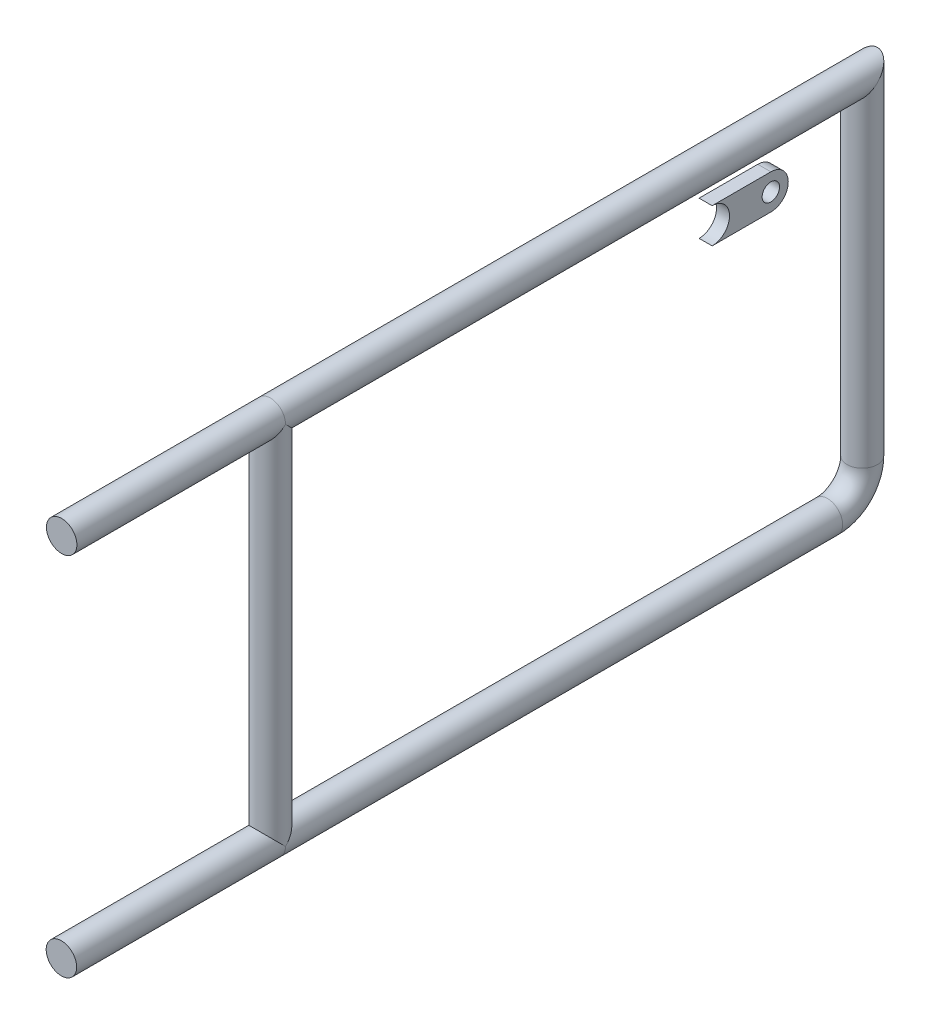
from build123d import *

# Parameters (mm, degrees)
SKETCH3_R           = 11.1125
SKETCH3_8_R         = 11.1125
SKETCH11_R          = 6.35
BOSS_EXTRUDE1_DEPTH = 9.525


with BuildPart() as part:
    # Sweep1: sweep along a path in Sketch1
    with BuildLine(Plane(origin=(0, 0, 0), x_dir=(0, 0, -1), z_dir=(1, 0, 0))) as sweep1_path:
        Line((0, -431.8), (152.212779539, -431.8))
        Line((152.212779539, -431.8), (584.012779539, -431.8))
        Line((584.012779539, -431.8), (584.012779539, -673.1))
        ThreePointArc((584.012779539, -673.1), (576.573291781, -691.060512242), (558.612779539, -698.5))
        Line((558.612779539, -698.5), (152.212779539, -698.5))
        Line((152.212779539, -698.5), (-0.187220461, -698.5))
    # Sketch3 → Sweep1 (sweep)
    with BuildSketch(Plane.XY):
        with Locations((0, -698.5)):
            Circle(SKETCH3_R)
    sweep(path=sweep1_path.line, transition=Transition.RIGHT)

    # Sweep2: sweep along a path in Sketch1<23>
    with BuildLine(Plane(origin=(0, 0, 0), x_dir=(0, 0, -1), z_dir=(1, 0, 0))) as sweep2_path:
        Line((-0.187220461, -698.5), (152.212779539, -698.5))
        Line((152.212779539, -698.5), (152.212779539, -431.8))
    # Sketch3<8> → Sweep2 (sweep)
    with BuildSketch(Plane.XY):
        with Locations((0, -698.5)):
            Circle(SKETCH3_8_R)
    sweep(path=sweep2_path.line, transition=Transition.RIGHT)


with BuildPart() as body_2:
    # Sketch11 → Boss-Extrude1 (new body)
    with BuildSketch(Plane(origin=(0, 0, 0), x_dir=(0, 0, -1), z_dir=(1, 0, 0))):
        with BuildLine():
            ThreePointArc((464.982017061, -450.85), (477.682017061, -463.55), (464.982017061, -476.25))
            Line((464.982017061, -476.25), (507.812779539, -476.25))
            ThreePointArc((507.812779539, -476.25), (520.512779539, -463.55), (507.812779539, -450.85))
            Line((507.812779539, -450.85), (464.982017061, -450.85))
        make_face()
        with Locations((507.812779539, -463.55)):
            Circle(SKETCH11_R, mode=Mode.SUBTRACT)
    extrude(amount=BOSS_EXTRUDE1_DEPTH)


solid = Compound([part.part, body_2.part])
